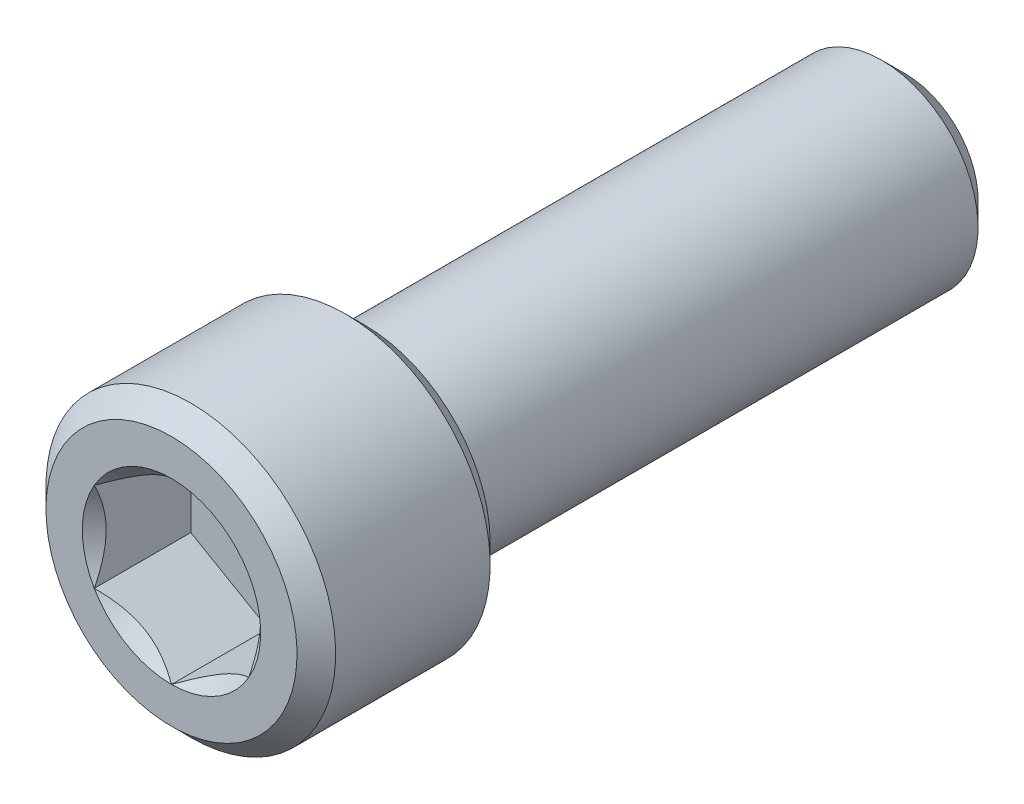
from build123d import *

# Parameters (mm, degrees)
CUT_EXTRUDE1_DEPTH = 3.96875


with BuildPart() as part:
    # Sketch3 → Revolve1 (revolve)
    with BuildSketch(Plane(origin=(0, 0, 0), x_dir=(0, 0, -1), z_dir=(1, 0, 0))):
        Polygon((15.08125, 0), (-15.08125, 0), (-15.08125, 5.159375), (-14.2875, 5.953125), (-7.9375, 5.953125), (-7.14375, 5.159375), (-7.14375, 3.9751), (14.093472222, 3.9751), (15.08125, 2.987322222), align=None)
    revolve(axis=Axis((0, 0, -15.08125), (0, 0, 1)))

    # Sketch4 → Cut-Extrude1 (cut)
    with BuildSketch(Plane.XY.offset(15.08125)):
        Polygon((0, -3.666174209), (3.175, -1.833087105), (3.175, 1.833087105), (0, 3.666174209), (-3.175, 1.833087105), (-3.175, -1.833087105), align=None)
    extrude(amount=-CUT_EXTRUDE1_DEPTH, mode=Mode.SUBTRACT)

    # Cut-Extrude3 cone 1 section (through the dimple's axis) → Cut-Extrude3 (revolve, cut)
    with BuildSketch(Plane(origin=(0, 0, 15.08125), x_dir=(0, -1, 0), z_dir=(1, 0, 0))):
        Polygon((0, 0), (3.666174209, 0), (0, 3.666174209), align=None)
    revolve(axis=Axis((0, 0, 15.08125), (0, 0, -1)), mode=Mode.SUBTRACT)


solid = part.part
